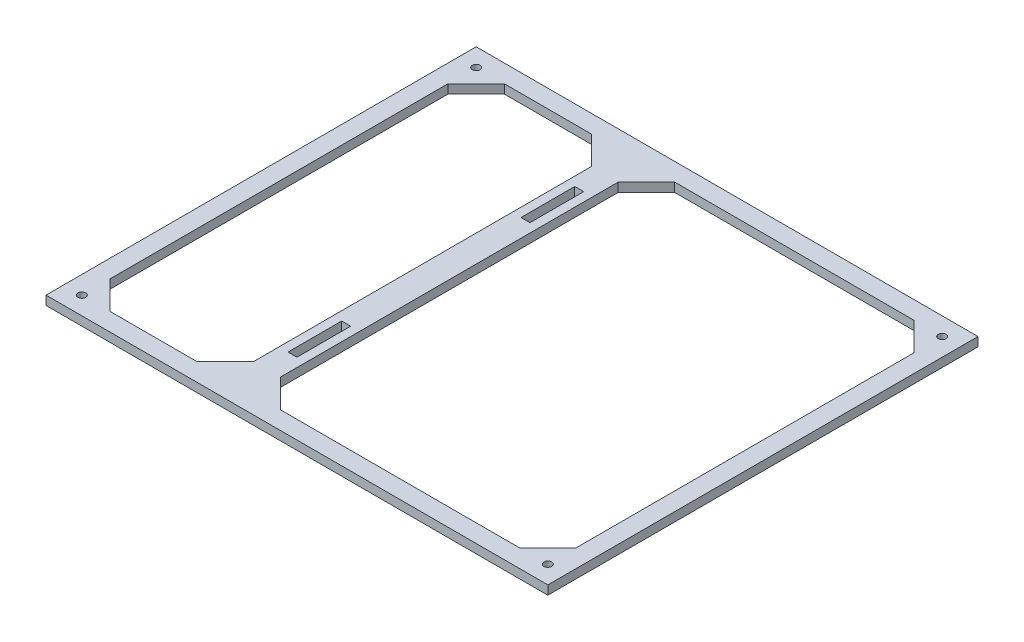
from build123d import *

# Parameters (mm, degrees)
SKETCH1_W           = 177.8
SKETCH1_H           = 152.4
SKETCH1_R           = 1.375
SKETCH1_W_2         = 3.175
SKETCH1_H_2         = 19.05
BOSS_EXTRUDE5_DEPTH = 3.175


with BuildPart() as part:
    # Sketch1 → Boss-Extrude5 (new body)
    with BuildSketch(Plane(origin=(0, 0, 0), x_dir=(1, 0, 0), z_dir=(0, 1, 0))):
        with Locations((88.9, 76.2)):
            Rectangle(SKETCH1_W, SKETCH1_H)
        with Locations(Location((6.35, 146.05, 0), (0, 0, 270))):
            Circle(SKETCH1_R, mode=Mode.SUBTRACT)
        with Locations(Location((6.35, 6.35, 0), (0, 0, 270))):
            Circle(SKETCH1_R, mode=Mode.SUBTRACT)
        with Locations(Location((171.45, 6.35, 0), (0, 0, 270))):
            Circle(SKETCH1_R, mode=Mode.SUBTRACT)
        with Locations(Location((171.45, 146.05, 0), (0, 0, 270))):
            Circle(SKETCH1_R, mode=Mode.SUBTRACT)
        Polygon((6.35, 16.35), (16.35, 6.35), (47.15, 6.35), (57.15, 16.35), (57.15, 136.05), (47.15, 146.05), (16.35, 146.05), (6.35, 136.05), align=None, mode=Mode.SUBTRACT)
        Polygon((76.675, 146.05), (161.45, 146.05), (171.45, 136.05), (171.45, 16.35), (161.45, 6.35), (76.675, 6.35), (66.675, 16.35), (66.675, 136.05), align=None, mode=Mode.SUBTRACT)
        with Locations((61.9125, 117.475)):
            Rectangle(SKETCH1_W_2, SKETCH1_H_2, mode=Mode.SUBTRACT)
        with Locations((61.9125, 34.925)):
            Rectangle(SKETCH1_W_2, SKETCH1_H_2, mode=Mode.SUBTRACT)
    extrude(amount=BOSS_EXTRUDE5_DEPTH)


solid = part.part
